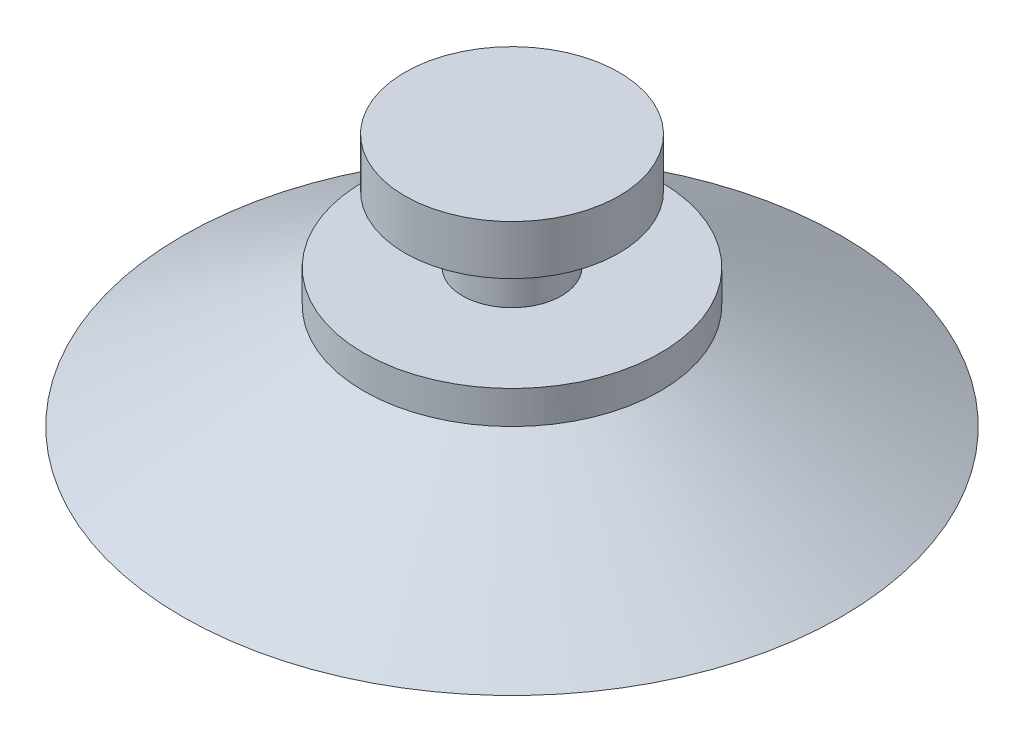
from build123d import *

# Parameters (mm, degrees)
SKETCH_1_R      = 1.5
EXTRUDE_1_DEPTH = 2
EXTRUDE_START   = 2
SKETCH_2_R      = 3.25
EXTRUDE_2_DEPTH = 1.5
SKETCH_3_R      = 4.5
EXTRUDE_3_DEPTH = 1


with BuildPart() as part:
    # 草图1 → 凸台-拉伸1 (new body)
    with BuildSketch(Plane(origin=(0, 0, 0), x_dir=(1, 0, 0), z_dir=(0, 1, 0))):
        with Locations(Location((0, 0, 0), (0, 0, 270))):
            Circle(SKETCH_1_R)
    extrude(amount=EXTRUDE_1_DEPTH)

    # 草图2 → 凸台-拉伸2 (add)
    with BuildSketch(Plane(origin=(0, 0, 0), x_dir=(1, 0, 0), z_dir=(0, 1, 0)).offset(EXTRUDE_START)):
        with Locations(Location((0, 0, 0), (0, 0, 270))):
            Circle(SKETCH_2_R)
    extrude(amount=EXTRUDE_2_DEPTH)

    # 草图3 → 凸台-拉伸3 (add)
    with BuildSketch(Plane(origin=(0, 0, 0), x_dir=(1, 0, 0), z_dir=(0, 1, 0))):
        with Locations(Location((0, 0, 0), (0, 0, 270))):
            Circle(SKETCH_3_R)
    extrude(amount=-EXTRUDE_3_DEPTH)

    # 草图4 → 旋转1 (revolve)
    with BuildSketch(Plane.XY):
        Polygon((4.5, -1), (10, -4.175426481), (8.5, -4.175426481), (3, -1), align=None)
    revolve(axis=Axis((0, -1000, 0), (0, 1, 0)))


solid = part.part
